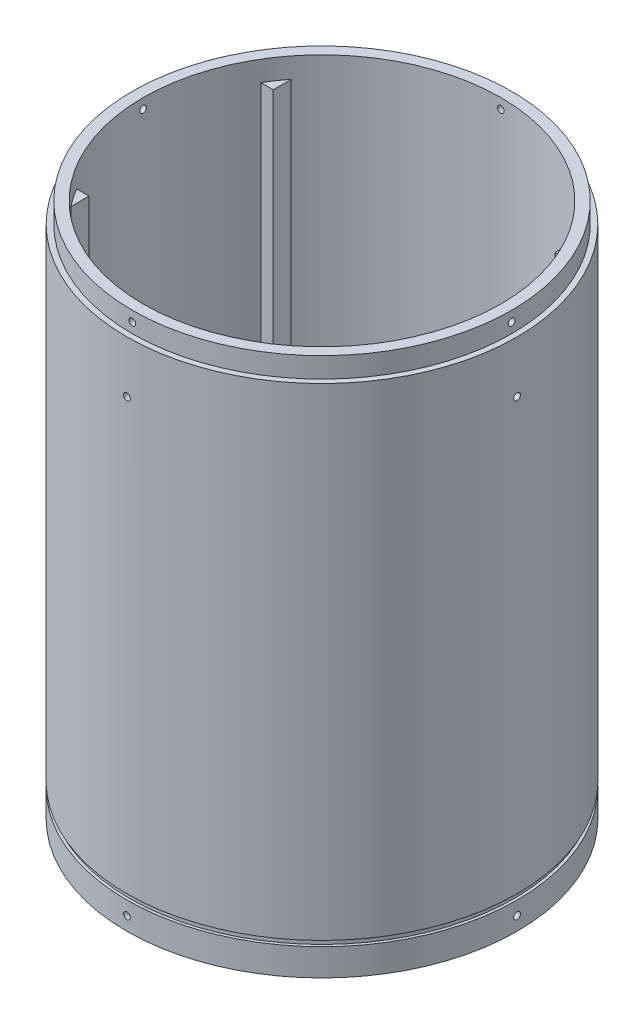
from build123d import *

# Parameters (mm, degrees)
SKETCH_6_R               = 72
SKETCH_6_R_2             = 70
EXTRUDE_1_DEPTH          = 190
SKETCH_6_15_R            = 70
SKETCH_6_15_R_2          = 66
EXTRUDE_2_DEPTH          = 197.5
SKETCH_6_16_R            = 66
EXTRUDE_3_DEPTH          = 3
EXTRUDE_6_DEPTH          = 190
F_2_5MM_3_D              = 2.5
F_2_5MM_3_DEPTH          = 70
PATTERN_CIRCULAR_1_COUNT = 4
SKETCH_33_W              = 1
SKETCH_33_H              = 2
PATTERN_CIRCULAR_2_COUNT = 4
PATTERN_CIRCULAR_3_COUNT = 4


with BuildPart() as part:
    # 草圖6 → 填料-伸長1 (new body)
    with BuildSketch(Plane(origin=(0, 0, 0), x_dir=(1, 0, 0), z_dir=(0, 1, 0))):
        with Locations(Location((0, 0, 0), (0, 0, 270))):
            Circle(SKETCH_6_R)
        with Locations(Location((0, 0, 0), (0, 0, 270))):
            Circle(SKETCH_6_R_2, mode=Mode.SUBTRACT)
    extrude(amount=EXTRUDE_1_DEPTH)

    # 草圖6<15> → 填料-伸長2 (add)
    with BuildSketch(Plane(origin=(0, 0, 0), x_dir=(1, 0, 0), z_dir=(0, 1, 0))):
        with Locations(Location((0, 0, 0), (0, 0, 90))):
            Circle(SKETCH_6_15_R)
        with Locations(Location((0, 0, 0), (0, 0, 90))):
            Circle(SKETCH_6_15_R_2, mode=Mode.SUBTRACT)
    extrude(amount=EXTRUDE_2_DEPTH)

    # 草圖6<16> → 填料-伸長3 (add)
    with BuildSketch(Plane(origin=(0, 0, 0), x_dir=(1, 0, 0), z_dir=(0, 1, 0))):
        with Locations(Location((0, 0, 0), (0, 0, 90))):
            Circle(SKETCH_6_16_R)
    extrude(amount=EXTRUDE_3_DEPTH)

    # 草圖9 → 填料-伸長6 (add)
    with BuildSketch(Plane(origin=(0, 0, 0), x_dir=(1, 0, 0), z_dir=(0, 1, 0))):
        with BuildLine():
            Line((-52, 34), (-52, 40.644802866))
            ThreePointArc((-52, 40.644802866), (-54.38584794, 37.392239086), (-56.568542495, 34))
            Line((-56.568542495, 34), (-52, 34))
        make_face()
        with BuildLine():
            Line((-52, -34), (-56.568542495, -34))
            ThreePointArc((-56.568542495, -34), (-54.38584794, -37.392239086), (-52, -40.644802866))
            Line((-52, -40.644802866), (-52, -34))
        make_face()
        with BuildLine():
            Line((56.568542495, -34), (52, -34))
            Line((52, -34), (52, -40.644802866))
            ThreePointArc((52, -40.644802866), (54.38584794, -37.392239086), (56.568542495, -34))
        make_face()
        with BuildLine():
            ThreePointArc((56.568542495, 34), (54.38584794, 37.392239086), (52, 40.644802866))
            Line((52, 40.644802866), (52, 34))
            Line((52, 34), (56.568542495, 34))
        make_face()
    extrude(amount=EXTRUDE_6_DEPTH)

    # Ø2.5mm 定位孔3
    with Locations(Plane(origin=(70, 193.75, 0), x_dir=(0, 0, 1), z_dir=(1, 0, 0))):
        with Locations((0, 0)):
            f_2_5mm_3 = Hole(F_2_5MM_3_D / 2, depth=F_2_5MM_3_DEPTH)

    # 環狀複製排列1: Ø2.5mm 定位孔3 ×4 about axis
    pattern_circular_1_axis = Axis((0, 197.5, 0), (0, 1, 0))
    for i in range(1, PATTERN_CIRCULAR_1_COUNT):
        add(f_2_5mm_3.rotate(pattern_circular_1_axis, i * 360 / PATTERN_CIRCULAR_1_COUNT), mode=Mode.SUBTRACT)

    # 草圖33 → 除料-旋轉1 (revolve, cut)
    with BuildSketch(Plane.XY, mode=Mode.PRIVATE) as cut_revolve_1_sk:
        with Locations((-71.5, 11)):
            Rectangle(SKETCH_33_W, SKETCH_33_H)
    revolve(cut_revolve_1_sk.sketch.rotate(Axis((0, 197.5, 0), (0, -1, 0)), 270), axis=Axis((0, 197.5, 0), (0, -1, 0)), mode=Mode.SUBTRACT)

    # 草圖37 → Ø2.5mm 定位孔4 (revolve, cut)
    with BuildSketch(Plane(origin=(-72, 5, 0), x_dir=(0, 0, 1), z_dir=(0, 1, 0))):
        Polygon((0, 0), (0, 4.751075774), (1.25, 4), (1.25, 0), align=None)
    f_2_5mm_4 = revolve(axis=Axis((-78.35, 5, 0), (1, 0, 0)), mode=Mode.SUBTRACT)

    # 環狀複製排列2: Ø2.5mm 定位孔4 ×4 about axis
    pattern_circular_2_axis = Axis((0, 197.5, 0), (0, -1, 0))
    for i in range(1, PATTERN_CIRCULAR_2_COUNT):
        add(f_2_5mm_4.rotate(pattern_circular_2_axis, i * 360 / PATTERN_CIRCULAR_2_COUNT), mode=Mode.SUBTRACT)

    # 草圖38 → Ø2.5mm 定位孔5 (revolve, cut)
    with BuildSketch(Plane(origin=(-72, 170.901826282, 0), x_dir=(0, 0, 1), z_dir=(0, 1, 0))):
        Polygon((0, 0), (0, 4.751075774), (1.25, 4), (1.25, 0), align=None)
    f_2_5mm_5 = revolve(axis=Axis((-78.35, 170.901826282, 0), (1, 0, 0)), mode=Mode.SUBTRACT)

    # 環狀複製排列3: Ø2.5mm 定位孔5 ×4 about axis
    pattern_circular_3_axis = Axis((0, 197.5, 0), (0, -1, 0))
    for i in range(1, PATTERN_CIRCULAR_3_COUNT):
        add(f_2_5mm_5.rotate(pattern_circular_3_axis, i * 360 / PATTERN_CIRCULAR_3_COUNT), mode=Mode.SUBTRACT)


solid = part.part
